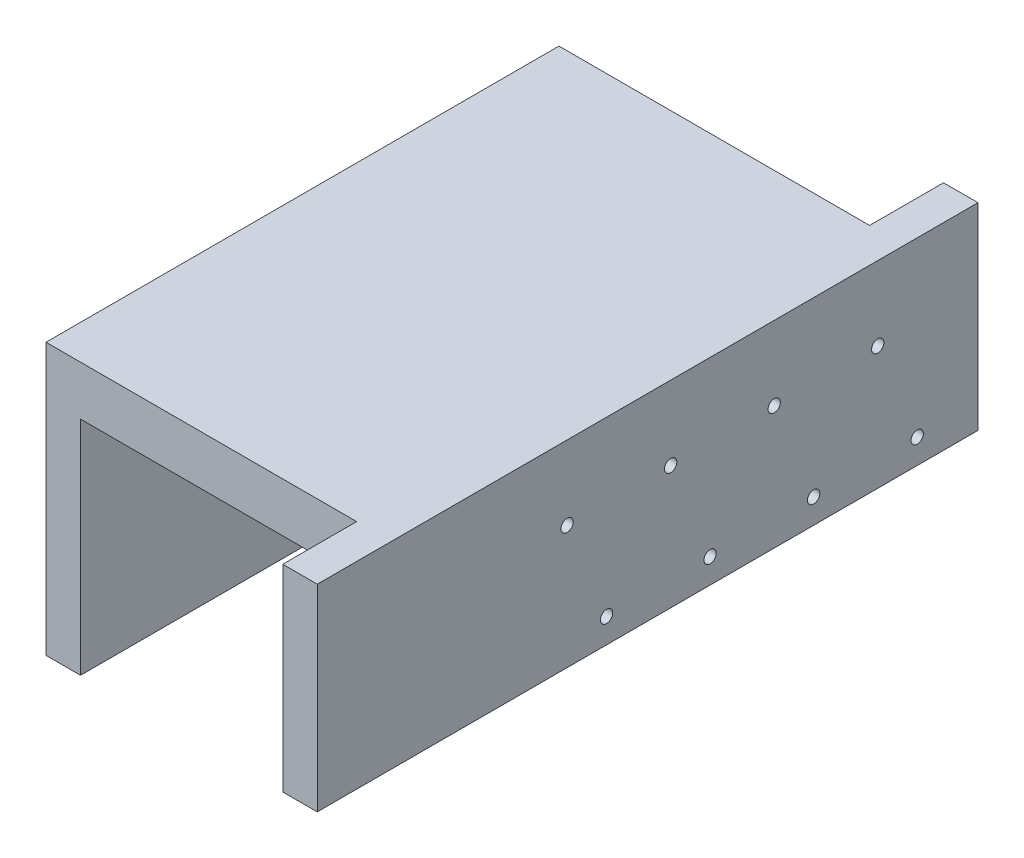
from build123d import *

# Parameters (mm, degrees)
SKETCH1_W                                           = 70
SKETCH1_H                                           = 55
BOSS_EXTRUDE1_DEPTH                                 = 134
CUT_EXTRUDE1_DEPTH                                  = 161.875728437
CUT_EXTRUDE1_DEPTH_BACK                             = 161.875728437
SKETCH4_R                                           = 1.25
CUT_EXTRUDE4_DEPTH                                  = 7
SKETCH5_W                                           = 14.985710671
SKETCH5_H                                           = 55
CUT_EXTRUDE5_DEPTH                                  = 63
CSK_FOR_M3_COUNTERSUNK_FLAT_HEAD_SCREW1_D           = 3.4
CSK_FOR_M3_COUNTERSUNK_FLAT_HEAD_SCREW1_DEPTH       = 10
CSK_FOR_M3_COUNTERSUNK_FLAT_HEAD_SCREW1_CSINK_D     = 6.3
CSK_FOR_M3_COUNTERSUNK_FLAT_HEAD_SCREW1_CSINK_ANGLE = 90
CSK_FOR_M3_COUNTERSUNK_FLAT_HEAD_SCREW1_TIP         = 1.021463052


with BuildPart() as part:
    # Sketch1 → Boss-Extrude1 (new body)
    with BuildSketch(Plane.XY):
        with Locations((35, 27.5)):
            Rectangle(SKETCH1_W, SKETCH1_H)
    extrude(amount=BOSS_EXTRUDE1_DEPTH)

    # Sketch2 → Cut-Extrude1 (cut, two sides: drawn at the far end of the back side and taken through both)
    with BuildSketch(Plane.XY.offset(134).offset(-CUT_EXTRUDE1_DEPTH_BACK)):
        Polygon((7, 0), (7, 45), (63, 45), (63, 15), (70, 15), (70, 0), (60, 0), align=None)
    extrude(amount=CUT_EXTRUDE1_DEPTH + CUT_EXTRUDE1_DEPTH_BACK, mode=Mode.SUBTRACT)

    # Sketch4 → Cut-Extrude4 (cut)
    with BuildSketch(Plane(origin=(70, 0, 0), x_dir=(0, 0, -1), z_dir=(1, 0, 0))):
        with Locations(Location((-83.331764561, 40, 0), (0, 0, 90))):
            Circle(SKETCH4_R)
        with Locations(Location((-75.331764561, 20, 0), (0, 0, 90))):
            Circle(SKETCH4_R)
        with Locations(Location((-62.331764561, 40, 0), (0, 0, 90))):
            Circle(SKETCH4_R)
        with Locations(Location((-54.331764561, 20, 0), (0, 0, 90))):
            Circle(SKETCH4_R)
        with Locations(Location((-41.331764561, 40, 0), (0, 0, 90))):
            Circle(SKETCH4_R)
        with Locations(Location((-33.331764561, 20, 0), (0, 0, 90))):
            Circle(SKETCH4_R)
        with Locations(Location((-20.331764561, 40, 0), (0, 0, 90))):
            Circle(SKETCH4_R)
        with Locations(Location((-12.331764561, 20, 0), (0, 0, 90))):
            Circle(SKETCH4_R)
    extrude(amount=-CUT_EXTRUDE4_DEPTH, mode=Mode.SUBTRACT)

    # Sketch5 → Cut-Extrude5 (cut)
    with BuildSketch(Plane.ZY):
        with Locations((7.492855336, 27.5)):
            Rectangle(SKETCH5_W, SKETCH5_H)
        with Locations((126.507144665, 27.5)):
            Rectangle(SKETCH5_W, SKETCH5_H)
    extrude(amount=-CUT_EXTRUDE5_DEPTH, mode=Mode.SUBTRACT)

    # CSK for M3 Countersunk Flat Head Screw1
    with Locations(Plane(origin=(7, 0, 0), x_dir=(0, 0, 1), z_dir=(1, 0, 0))):
        with Locations((52.691317064, -39.454373601), (52.691317064, -14.054373601), (80.631317064, -14.054373601), (80.631317064, -39.454373601)):
            CounterSinkHole(CSK_FOR_M3_COUNTERSUNK_FLAT_HEAD_SCREW1_D / 2, CSK_FOR_M3_COUNTERSUNK_FLAT_HEAD_SCREW1_CSINK_D / 2, depth=CSK_FOR_M3_COUNTERSUNK_FLAT_HEAD_SCREW1_DEPTH, counter_sink_angle=CSK_FOR_M3_COUNTERSUNK_FLAT_HEAD_SCREW1_CSINK_ANGLE)
            with Locations((0, 0, -(CSK_FOR_M3_COUNTERSUNK_FLAT_HEAD_SCREW1_DEPTH + CSK_FOR_M3_COUNTERSUNK_FLAT_HEAD_SCREW1_TIP / 2))):  # 118° drill point
                Cone(0, CSK_FOR_M3_COUNTERSUNK_FLAT_HEAD_SCREW1_D / 2, CSK_FOR_M3_COUNTERSUNK_FLAT_HEAD_SCREW1_TIP, mode=Mode.SUBTRACT)


solid = part.part
